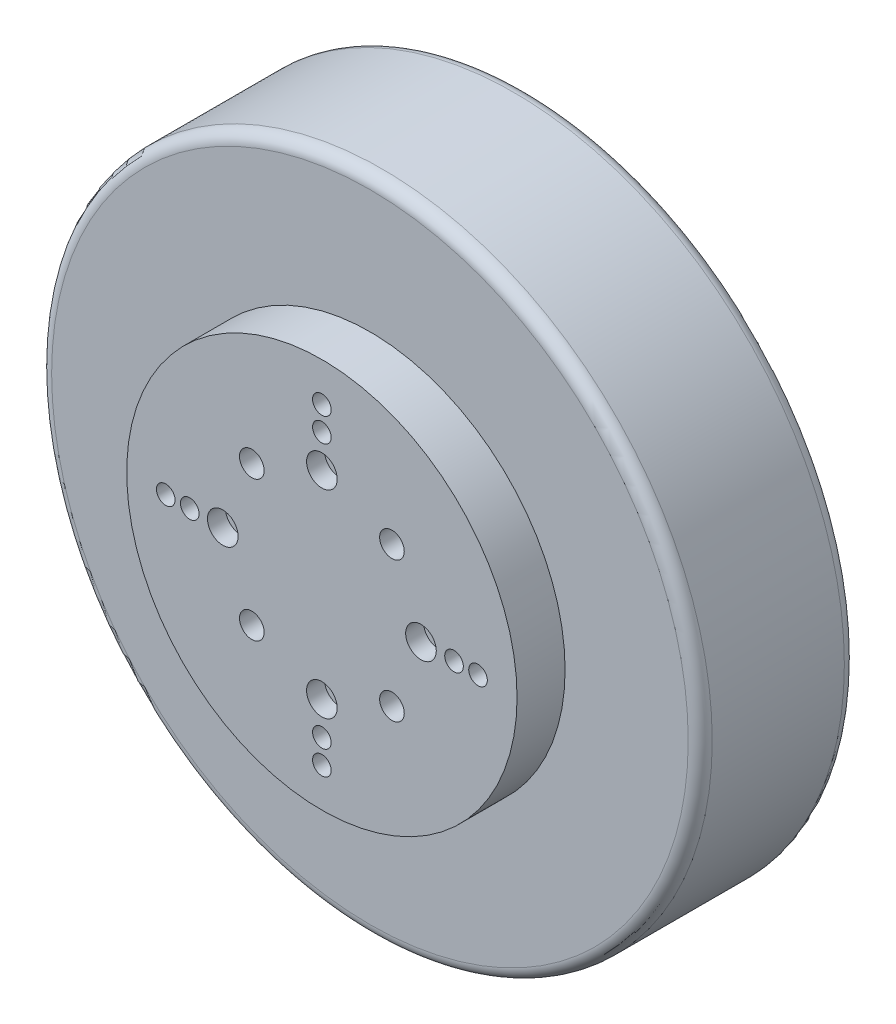
from build123d import *

# Parameters (mm, degrees)
SKETCH1_R           = 55
BOSS_EXTRUDE1_DEPTH = 26
SKETCH2_R           = 1.5
CUT_EXTRUDE1_DEPTH  = 3
SKETCH3_R           = 32.5
BOSS_EXTRUDE2_DEPTH = 8
SKETCH4_R           = 2.55
SKETCH4_R_2         = 1.55
SKETCH4_R_3         = 2.05
CUT_EXTRUDE2_DEPTH  = 3
FILLET1_R           = 2


with BuildPart() as part:
    # Sketch1 → Boss-Extrude1 (new body)
    with BuildSketch(Plane.XY):
        with Locations(Location((0, 0, 0), (0, 0, 180))):
            Circle(SKETCH1_R)
    extrude(amount=BOSS_EXTRUDE1_DEPTH)

    # Sketch2 → Cut-Extrude1 (cut)
    with BuildSketch(Plane(origin=(0, 0, 0), x_dir=(-1, 0, 0), z_dir=(0, 0, -1))):
        with Locations((0, -21)):
            Circle(SKETCH2_R)
        with Locations((-14.849242405, -14.849242405)):
            Circle(SKETCH2_R)
        with Locations((-21, 0)):
            Circle(SKETCH2_R)
        with Locations((-14.849242405, 14.849242405)):
            Circle(SKETCH2_R)
        with Locations((0, 21)):
            Circle(SKETCH2_R)
        with Locations((14.849242405, 14.849242405)):
            Circle(SKETCH2_R)
        with Locations((21, 0)):
            Circle(SKETCH2_R)
        with Locations((14.849242405, -14.849242405)):
            Circle(SKETCH2_R)
    extrude(amount=-CUT_EXTRUDE1_DEPTH, mode=Mode.SUBTRACT)

    # Sketch3 → Boss-Extrude2 (add)
    with BuildSketch(Plane.XY.offset(26)):
        Circle(SKETCH3_R)
    extrude(amount=BOSS_EXTRUDE2_DEPTH)

    # Sketch4 → Cut-Extrude2 (cut)
    with BuildSketch(Plane.XY.offset(34)):
        with Locations((-16.5, 0)):
            Circle(SKETCH4_R)
        with Locations((0, -16.5)):
            Circle(SKETCH4_R)
        with Locations((16.5, 0)):
            Circle(SKETCH4_R)
        with Locations((0, 16.5)):
            Circle(SKETCH4_R)
        with Locations((0, 26)):
            Circle(SKETCH4_R_2)
        with Locations((0, 22)):
            Circle(SKETCH4_R_2)
        with Locations((-11.66726189, -11.66726189)):
            Circle(SKETCH4_R_3)
        with Locations((11.66726189, -11.66726189)):
            Circle(SKETCH4_R_3)
        with Locations((11.66726189, 11.66726189)):
            Circle(SKETCH4_R_3)
        with Locations((-11.66726189, 11.66726189)):
            Circle(SKETCH4_R_3)
        with Locations((-22, 0)):
            Circle(SKETCH4_R_2)
        with Locations((-26, 0)):
            Circle(SKETCH4_R_2)
        with Locations((0, -22)):
            Circle(SKETCH4_R_2)
        with Locations((0, -26)):
            Circle(SKETCH4_R_2)
        with Locations((22, 0)):
            Circle(SKETCH4_R_2)
        with Locations((26, 0)):
            Circle(SKETCH4_R_2)
    extrude(amount=-CUT_EXTRUDE2_DEPTH, mode=Mode.SUBTRACT)

    # Fillet1
    fillet1_edges = [part.edges().sort_by_distance(p)[0] for p in [
        (55, 0, 0),
        (55, 0, 26),
    ]]
    fillet(fillet1_edges, radius=FILLET1_R)


solid = part.part
